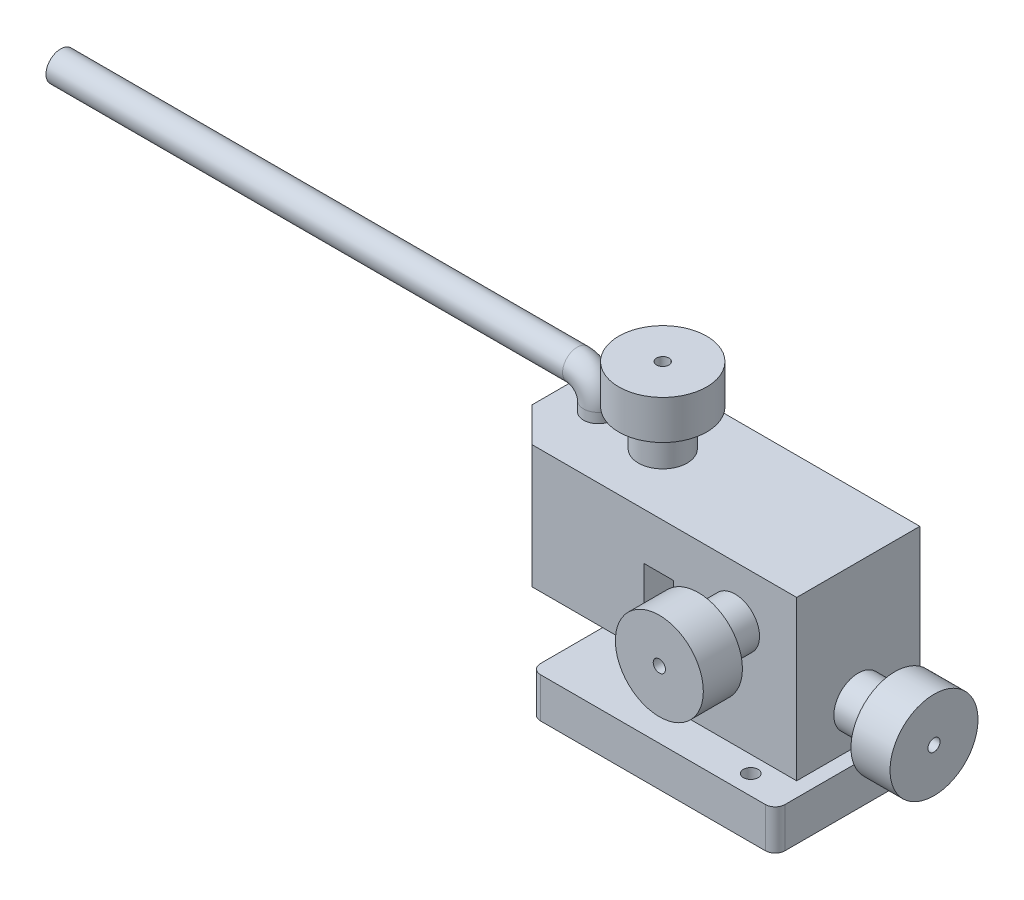
from build123d import *

# Parameters (mm, degrees)
BOSS_EXTRUDE1_DEPTH  = 8.2
SKETCH2_W            = 25.2
SKETCH2_H            = 25.2
BOSS_EXTRUDE2_DEPTH  = 32.5
SKETCH3_W            = 25.2
SKETCH3_H            = 9.6
BOSS_EXTRUDE3_DEPTH  = 6
SKETCH4_W            = 25.2
SKETCH4_H            = 25.2
BOSS_EXTRUDE4_DEPTH  = 30
CHAMFER1_SIZE        = 7
SKETCH5_R            = 5
BOSS_EXTRUDE5_DEPTH  = 7.5
SKETCH6_R            = 9
BOSS_EXTRUDE6_DEPTH  = 8
SKETCH7_R            = 1.25
CUT_EXTRUDE1_DEPTH   = 4
SKETCH8_R            = 5
BOSS_EXTRUDE7_DEPTH  = 7.5
SKETCH9_R            = 9
BOSS_EXTRUDE8_DEPTH  = 8
SKETCH10_R           = 1.25
CUT_EXTRUDE2_DEPTH   = 4
SKETCH11_R           = 5
BOSS_EXTRUDE9_DEPTH  = 7.5
SKETCH12_R           = 9
BOSS_EXTRUDE10_DEPTH = 8
SKETCH13_R           = 1.25
CUT_EXTRUDE3_DEPTH   = 4
SKETCH15_R           = 3
CUT_EXTRUDE4_REACH   = 139.748
SKETCH16_R           = 1.5
BOSS_EXTRUDE11_START = 7.5
SKETCH17_R           = 5
BOSS_EXTRUDE11_DEPTH = 7.5
BOSS_EXTRUDE12_START = 8
SKETCH19_R           = 9
BOSS_EXTRUDE12_DEPTH = 8
CUT_EXTRUDE5_START   = -4
SKETCH20_R           = 1.25
CUT_EXTRUDE5_DEPTH   = 4
SKETCH21_W           = 25.2
SKETCH21_H           = 23.393647367
CUT_EXTRUDE6_DEPTH   = 136.341678725


with BuildPart() as part:
    # Sketch1 → Boss-Extrude1 (new body)
    with BuildSketch(Plane(origin=(0, 0, 0), x_dir=(1, 0, 0), z_dir=(0, 1, 0))):
        with BuildLine():
            Line((2, 0), (48, 0))
            ThreePointArc((48, 0), (49.414213562, 0.585786438), (50, 2))
            Line((50, 2), (50, 38))
            ThreePointArc((50, 38), (49.414213562, 39.414213562), (48, 40))
            Line((48, 40), (2, 40))
            ThreePointArc((2, 40), (0.585786438, 39.414213562), (0, 38))
            Line((0, 38), (0, 2))
            ThreePointArc((0, 2), (0.585786438, 0.585786438), (2, 0))
        make_face()
    extrude(amount=BOSS_EXTRUDE1_DEPTH)

    # Sketch2 → Boss-Extrude2 (add)
    with BuildSketch(Plane(origin=(0, 8.2, 0), x_dir=(1, 0, 0), z_dir=(0, 1, 0))):
        with Locations((34.4, 20)):
            Rectangle(SKETCH2_W, SKETCH2_H)
    extrude(amount=BOSS_EXTRUDE2_DEPTH)

    # Sketch3 → Boss-Extrude3 (add)
    with BuildSketch(Plane.ZY.offset(-21.8)):
        with Locations((-20, 35.9)):
            Rectangle(SKETCH3_W, SKETCH3_H)
    extrude(amount=BOSS_EXTRUDE3_DEPTH)

    # Sketch4 → Boss-Extrude4 (add)
    with BuildSketch(Plane.ZY.offset(-15.8)):
        with Locations((-20, 28.1)):
            Rectangle(SKETCH4_W, SKETCH4_H)
    extrude(amount=BOSS_EXTRUDE4_DEPTH)

    # Chamfer1
    chamfer1_edges = [part.edges().sort_by_distance(p)[0] for p in [
        (-14.2, 28.1, -7.4),
        (-14.2, 28.1, -32.6),
    ]]
    chamfer(chamfer1_edges, length=CHAMFER1_SIZE)

    # Sketch5 → Boss-Extrude5 (add)
    with BuildSketch(Plane(origin=(47, 0, 0), x_dir=(0, 0, -1), z_dir=(1, 0, 0))):
        with Locations((20, 16)):
            Circle(SKETCH5_R)
    extrude(amount=BOSS_EXTRUDE5_DEPTH)

    # Sketch6 → Boss-Extrude6 (add)
    with BuildSketch(Plane(origin=(54.5, 0, 0), x_dir=(0, 0, -1), z_dir=(1, 0, 0))):
        with Locations((20, 16)):
            Circle(SKETCH6_R)
    extrude(amount=BOSS_EXTRUDE6_DEPTH)

    # Sketch7 → Cut-Extrude1 (cut)
    with BuildSketch(Plane(origin=(62.5, 0, 0), x_dir=(0, 0, -1), z_dir=(1, 0, 0))):
        with Locations((20, 16)):
            Circle(SKETCH7_R)
    extrude(amount=-CUT_EXTRUDE1_DEPTH, mode=Mode.SUBTRACT)

    # Sketch8 → Boss-Extrude7 (add)
    with BuildSketch(Plane(origin=(0, 0, -32.6), x_dir=(-1, 0, 0), z_dir=(0, 0, -1))):
        with Locations((-34.4, 30)):
            Circle(SKETCH8_R)
    extrude(amount=BOSS_EXTRUDE7_DEPTH)

    # Sketch9 → Boss-Extrude8 (add)
    with BuildSketch(Plane(origin=(0, 0, -40.1), x_dir=(-1, 0, 0), z_dir=(0, 0, -1))):
        with Locations((-34.4, 30)):
            Circle(SKETCH9_R)
    extrude(amount=BOSS_EXTRUDE8_DEPTH)

    # Sketch10 → Cut-Extrude2 (cut)
    with BuildSketch(Plane(origin=(0, 0, -48.1), x_dir=(-1, 0, 0), z_dir=(0, 0, -1))):
        with Locations((-34.4, 30)):
            Circle(SKETCH10_R)
    extrude(amount=-CUT_EXTRUDE2_DEPTH, mode=Mode.SUBTRACT)

    # Sketch11 → Boss-Extrude9 (add)
    with BuildSketch(Plane(origin=(0, 40.7, 0), x_dir=(1, 0, 0), z_dir=(0, 1, 0))):
        with Locations((7, 20)):
            Circle(SKETCH11_R)
    extrude(amount=BOSS_EXTRUDE9_DEPTH)

    # Sketch12 → Boss-Extrude10 (add)
    with BuildSketch(Plane(origin=(0, 48.2, 0), x_dir=(1, 0, 0), z_dir=(0, 1, 0))):
        with Locations((7, 20)):
            Circle(SKETCH12_R)
    extrude(amount=BOSS_EXTRUDE10_DEPTH)

    # Sketch13 → Cut-Extrude3 (cut)
    with BuildSketch(Plane(origin=(0, 56.2, 0), x_dir=(1, 0, 0), z_dir=(0, 1, 0))):
        with Locations((7, 20)):
            Circle(SKETCH13_R)
    extrude(amount=-CUT_EXTRUDE3_DEPTH, mode=Mode.SUBTRACT)

    # Sweep1: sweep along a path in Sketch14
    with BuildLine(Plane.XY.offset(-20)) as sweep1_path:
        Line((-6.2, 40.7), (-6.2, 42.7))
        ThreePointArc((-6.2, 42.7), (-7.459440841, 45.740559159), (-10.5, 47))
        Line((-10.5, 47), (-116.2, 47))
    # Sketch15 → Sweep1 (sweep)
    with BuildSketch(Plane(origin=(-116.2, 0, 0), x_dir=(0, 0, -1), z_dir=(1, 0, 0))):
        with Locations((20, 47)):
            Circle(SKETCH15_R)
    sweep(path=sweep1_path.line)

    # Sketch16 → Cut-Extrude4 (cut, up to next)
    with BuildSketch(Plane.XZ, mode=Mode.PRIVATE) as cut_extrude4_sk1:
        with Locations((41, -4)):
            Circle(SKETCH16_R)
    cut_extrude4_tool1 = extrude(cut_extrude4_sk1.sketch, amount=-CUT_EXTRUDE4_REACH, mode=Mode.PRIVATE) & part.part
    # Sketch16 → Cut-Extrude4 (cut, up to next)
    with BuildSketch(Plane.XZ, mode=Mode.PRIVATE) as cut_extrude4_sk2:
        with Locations((41, -36)):
            Circle(SKETCH16_R)
    cut_extrude4_tool2 = extrude(cut_extrude4_sk2.sketch, amount=-CUT_EXTRUDE4_REACH, mode=Mode.PRIVATE) & part.part
    add(cut_extrude4_tool1.solids().sort_by_distance((41, 0, -4))[0], mode=Mode.SUBTRACT)
    add(cut_extrude4_tool2.solids().sort_by_distance((41, 0, -36))[0], mode=Mode.SUBTRACT)

    # Sketch17 → Boss-Extrude11 (add)
    with BuildSketch(Plane.XY.offset(-7.4).offset(BOSS_EXTRUDE11_START)):
        with Locations((34.4, 30)):
            Circle(SKETCH17_R)
    extrude(amount=-BOSS_EXTRUDE11_DEPTH)

    # Sketch19 → Boss-Extrude12 (add)
    with BuildSketch(Plane.XY.offset(0.1).offset(BOSS_EXTRUDE12_START)):
        with Locations((34.4, 30)):
            Circle(SKETCH19_R)
    extrude(amount=-BOSS_EXTRUDE12_DEPTH)

    # Sketch20 → Cut-Extrude5 (cut)
    with BuildSketch(Plane.XY.offset(8.1).offset(CUT_EXTRUDE5_START)):
        with Locations((34.4, 30)):
            Circle(SKETCH20_R)
    extrude(amount=CUT_EXTRUDE5_DEPTH, mode=Mode.SUBTRACT)

    # Sketch21 → Cut-Extrude6 (cut, through all)
    with BuildSketch(Plane(origin=(0, 0, -32.6), x_dir=(-1, 0, 0), z_dir=(0, 0, -1))):
        with Locations((-34.4, 29.003176317)):
            Rectangle(SKETCH21_W, SKETCH21_H)
    extrude(amount=CUT_EXTRUDE6_DEPTH, mode=Mode.SUBTRACT)


solid = part.part
